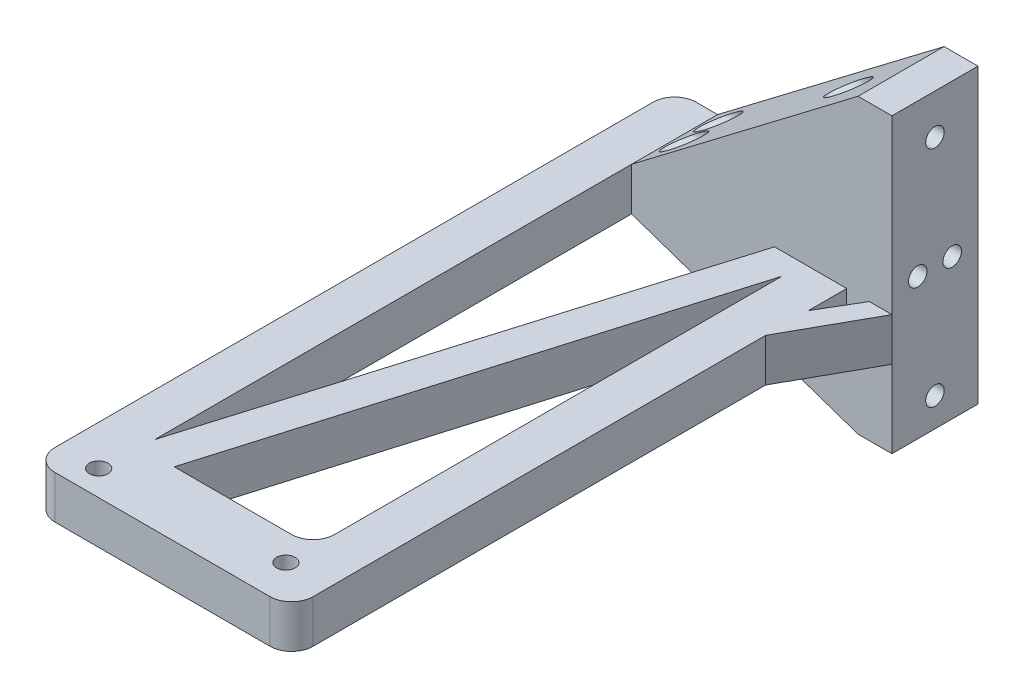
from build123d import *

# Parameters (mm, degrees)
EXTRUDE_1_DEPTH                 = 10
SKETCH_4_W                      = 7.875
SKETCH_4_H                      = 20
EXTRUDE_2_DEPTH                 = 40
CUT_EXTRUDE_1_REACH             = 116.35
SKETCH_5_R                      = 2.15
CUT_EXTRUDE_1_DIRECTION_2_DEPTH = 53
CUT_EXTRUDE_2_REACH             = 107.272
SKETCH_6_R                      = 2.15
FILLET_1_R                      = 5
FILLET_2_R                      = 5
SKETCH_7_W                      = 7.875
SKETCH_7_H                      = 20
EXTRUDE_3_DEPTH                 = 18
CUT_EXTRUDE_3_REACH             = 116.35
SKETCH_8_R                      = 2.15
EXTRUDE_8_DEPTH                 = 20
SKETCH_15_W                     = 52.625
SKETCH_15_H                     = 20
EXTRUDE_9_DEPTH                 = 40
CUT_EXTRUDE_START               = -7.875
SKETCH_14_R                     = 3.5
CUT_EXTRUDE_8_DEPTH             = 54
CUT_EXTRUDE_10_DEPTH            = 20


with BuildPart() as part:
    # 草图1 → 凸台-拉伸1 (new body)
    with BuildSketch(Plane(origin=(0, 0, 0), x_dir=(1, 0, 0), z_dir=(0, 1, 0))):
        Polygon((5.931150433, 81.572237736), (53.180774799, 81.572237736), (53.180774799, 61.572237736), (42.680774799, 42.721022935), (42.680774799, 31.757290204), (42.680774799, -57.600660719), (42.680774799, -67.427762264), (0.431150433, -67.427762264), (-17.319225201, -67.427762264), (-17.319225201, 81.572237736), align=None)
        Polygon((47.930774799, 61.572237736), (42.680774799, 61.572237736), (42.680774799, 52.689495612), align=None, mode=Mode.SUBTRACT)
        Polygon((25.906315323, 61.572237736), (-7.319225201, 61.572237736), (-7.319225201, -49.220735683), align=None, mode=Mode.SUBTRACT)
        Polygon((0.431150433, -52.427762264), (32.680774799, -52.427762264), (32.680774799, 56.508121895), align=None, mode=Mode.SUBTRACT)
    extrude(amount=EXTRUDE_1_DEPTH)

    # 草图4 → 凸台-拉伸2 (add)
    with BuildSketch(Plane(origin=(0, 10, 0), x_dir=(1, 0, 0), z_dir=(0, 1, 0))):
        with Locations((49.243274799, 71.572237736)):
            Rectangle(SKETCH_4_W, SKETCH_4_H)
    extrude(amount=EXTRUDE_2_DEPTH)

    # 草图5 → 切除-拉伸1 (cut, up to next)
    with BuildSketch(Plane.ZY.offset(-45.305774799), mode=Mode.PRIVATE) as cut_extrude_1_sk1:
        with Locations(Location((-75.572237736, 14.7, 0), (0, 0, 180))):
            Circle(SKETCH_5_R)
    cut_extrude_1_tool1 = extrude(cut_extrude_1_sk1.sketch, amount=-CUT_EXTRUDE_1_REACH, mode=Mode.PRIVATE) & part.part
    # 草图5 → 切除-拉伸1 (cut, up to next)
    with BuildSketch(Plane.ZY.offset(-45.305774799), mode=Mode.PRIVATE) as cut_extrude_1_sk2:
        with Locations(Location((-67.572237736, 14.7, 0), (0, 0, 180))):
            Circle(SKETCH_5_R)
    cut_extrude_1_tool2 = extrude(cut_extrude_1_sk2.sketch, amount=-CUT_EXTRUDE_1_REACH, mode=Mode.PRIVATE) & part.part
    # 草图5 → 切除-拉伸1 (cut, up to next)
    with BuildSketch(Plane.ZY.offset(-45.305774799), mode=Mode.PRIVATE) as cut_extrude_1_sk3:
        with Locations(Location((-71.572237736, 40.7, 0), (0, 0, 180))):
            Circle(SKETCH_5_R)
    cut_extrude_1_tool3 = extrude(cut_extrude_1_sk3.sketch, amount=-CUT_EXTRUDE_1_REACH, mode=Mode.PRIVATE) & part.part
    add(cut_extrude_1_tool1.solids().sort_by_distance((45.305775, 14.7, -75.572238))[0], mode=Mode.SUBTRACT)
    add(cut_extrude_1_tool2.solids().sort_by_distance((45.305775, 14.7, -67.572238))[0], mode=Mode.SUBTRACT)
    add(cut_extrude_1_tool3.solids().sort_by_distance((45.305775, 40.7, -71.572238))[0], mode=Mode.SUBTRACT)

    # 草图5 → 切除-拉伸1 direction 2 (cut)
    with BuildSketch(Plane.ZY.offset(-45.305774799)):
        with Locations(Location((-75.572237736, 14.7, 0), (0, 0, 180))):
            Circle(SKETCH_5_R)
        with Locations(Location((-67.572237736, 14.7, 0), (0, 0, 180))):
            Circle(SKETCH_5_R)
        with Locations(Location((-71.572237736, 40.7, 0), (0, 0, 180))):
            Circle(SKETCH_5_R)
    extrude(amount=CUT_EXTRUDE_1_DIRECTION_2_DEPTH, mode=Mode.SUBTRACT)

    # 草图6 → 切除-拉伸2 (cut, up to next)
    with BuildSketch(Plane(origin=(0, 10, 0), x_dir=(1, 0, 0), z_dir=(0, 1, 0)), mode=Mode.PRIVATE) as cut_extrude_2_sk1:
        with Locations(Location((-8.019225201, -61.542634482, 0), (0, 0, 270))):
            Circle(SKETCH_6_R)
    cut_extrude_2_tool1 = extrude(cut_extrude_2_sk1.sketch, amount=-CUT_EXTRUDE_2_REACH, mode=Mode.PRIVATE) & part.part
    # 草图6 → 切除-拉伸2 (cut, up to next)
    with BuildSketch(Plane(origin=(0, 10, 0), x_dir=(1, 0, 0), z_dir=(0, 1, 0)), mode=Mode.PRIVATE) as cut_extrude_2_sk2:
        with Locations(Location((32.680774799, -58.742634482, 0), (0, 0, 270))):
            Circle(SKETCH_6_R)
    cut_extrude_2_tool2 = extrude(cut_extrude_2_sk2.sketch, amount=-CUT_EXTRUDE_2_REACH, mode=Mode.PRIVATE) & part.part
    add(cut_extrude_2_tool1.solids().sort_by_distance((-8.019225, 10, 61.542634))[0], mode=Mode.SUBTRACT)
    add(cut_extrude_2_tool2.solids().sort_by_distance((32.680775, 10, 58.742634))[0], mode=Mode.SUBTRACT)

    # 圆角1
    fillet_1_edges = [part.edges().sort_by_distance(p)[0] for p in [
        (-17.319225201, 5, 67.427762264),
        (-17.319225201, 5, -81.572237736),
        (42.680774799, 5, 67.427762264),
    ]]
    fillet(fillet_1_edges, radius=FILLET_1_R)

    # 圆角2
    fillet_2_edges = [part.edges().sort_by_distance(p)[0] for p in [
        (32.680774799, 5, 52.427762264),
    ]]
    fillet(fillet_2_edges, radius=FILLET_2_R)

    # 草图7 → 凸台-拉伸3 (add)
    with BuildSketch(Plane.XZ):
        with Locations((49.243274799, -71.572237736)):
            Rectangle(SKETCH_7_W, SKETCH_7_H)
    extrude(amount=EXTRUDE_3_DEPTH)

    # 草图8 → 切除-拉伸3 (cut, up to next)
    with BuildSketch(Plane.ZY.offset(-45.305774799), mode=Mode.PRIVATE) as cut_extrude_3_sk1:
        with Locations((-71.572237736, -11.3)):
            Circle(SKETCH_8_R)
    cut_extrude_3_tool1 = extrude(cut_extrude_3_sk1.sketch, amount=-CUT_EXTRUDE_3_REACH, mode=Mode.PRIVATE) & part.part
    add(cut_extrude_3_tool1.solids().sort_by_distance((45.305775, -11.3, -71.572238))[0], mode=Mode.SUBTRACT)

    # 草图13 → 凸台-拉伸8 (add)
    with BuildSketch(Plane.XY.offset(-61.572237736)):
        Polygon((45.305774799, 0), (45.305774799, -18), (-7.319225201, 0), align=None)
    extrude(amount=-EXTRUDE_8_DEPTH)

    # 草图15 → 凸台-拉伸9 (add)
    with BuildSketch(Plane(origin=(0, 10, 0), x_dir=(1, 0, 0), z_dir=(0, 1, 0))):
        with Locations((18.993274799, 71.572237736)):
            Rectangle(SKETCH_15_W, SKETCH_15_H)
    extrude(amount=EXTRUDE_9_DEPTH)

    # 草图14 → 切除-拉伸8 (cut)
    with BuildSketch(Plane(origin=(53.180774799, 0, 0), x_dir=(0, 0, -1), z_dir=(1, 0, 0)).offset(CUT_EXTRUDE_START)):
        with Locations((71.572237736, 40.7)):
            Circle(SKETCH_14_R)
        with Locations((67.572237736, 14.7)):
            Circle(SKETCH_14_R)
        with Locations((75.572237736, 14.7)):
            Circle(SKETCH_14_R)
        with Locations((71.572237736, -11.3)):
            Circle(SKETCH_14_R)
    extrude(amount=-CUT_EXTRUDE_8_DEPTH, mode=Mode.SUBTRACT)

    # 草图17 → 切除-拉伸10 (cut)
    with BuildSketch(Plane.XY.offset(-61.572237736)):
        Polygon((-7.319225201, 10), (-7.319225201, 50), (45.305774799, 50), align=None)
    extrude(amount=-CUT_EXTRUDE_10_DEPTH, mode=Mode.SUBTRACT)


solid = part.part
